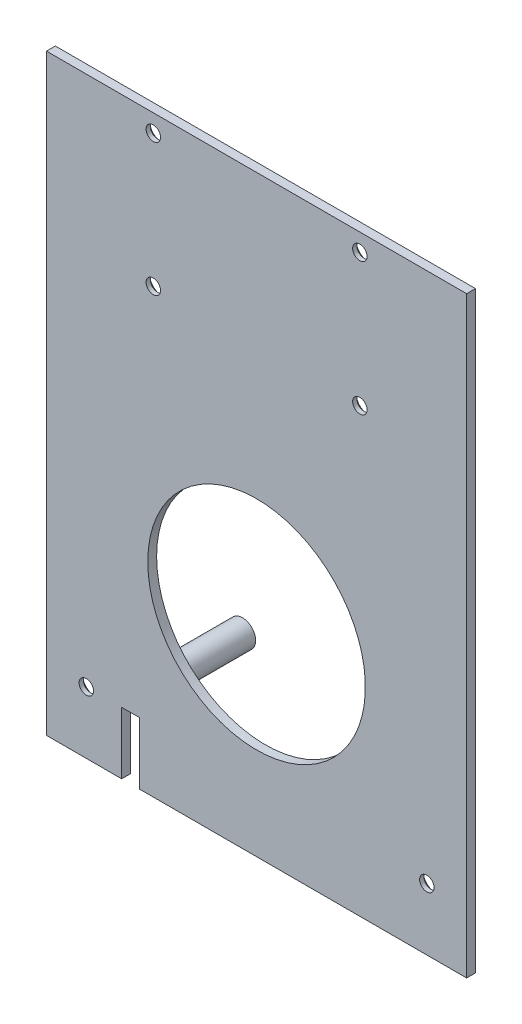
from build123d import *

# Parameters (mm, degrees)
SKETCH1_W                                 = 95
SKETCH1_H                                 = 134
BOSS_EXTRUDE1_DEPTH                       = 2
CSK_FOR_4_FLAT_HEAD_MACHINE_SCREW_2_COUNT = 2
CSK_FOR_4_FLAT_HEAD_MACHINE_SCREW_2_PITCH = 46.7
CSK_FOR_4_FLAT_HEAD_MACHINE_SCREW_3_COUNT = 2
CSK_FOR_4_FLAT_HEAD_MACHINE_SCREW_3_PITCH = 55.505765466
CSK_FOR_4_FLAT_HEAD_MACHINE_SCREW_4_COUNT = 2
CSK_FOR_4_FLAT_HEAD_MACHINE_SCREW_4_PITCH = 30
CSK_FOR_4_FLAT_HEAD_MACHINE_SCREW_5_COUNT = 2
CSK_FOR_4_FLAT_HEAD_MACHINE_SCREW_5_PITCH = 116.985137945
CSK_FOR_4_FLAT_HEAD_MACHINE_SCREW_6_COUNT = 2
CSK_FOR_4_FLAT_HEAD_MACHINE_SCREW_6_PITCH = 131.458824352
SKETCH13_R                                = 24.6
CUT_EXTRUDE2_DEPTH                        = 165.271117364
SKETCH14_R                                = 3
BOSS_EXTRUDE4_DEPTH                       = 19.3
SKETCH15_R                                = 1.15
CUT_EXTRUDE3_DEPTH                        = 15
SKETCH16_W                                = 4
SKETCH16_H                                = 14
CUT_EXTRUDE4_DEPTH                        = 166.388905311


with BuildPart() as part:
    # Sketch1 → Boss-Extrude1 (new body)
    with BuildSketch(Plane.XY):
        with Locations((47.5, 67)):
            Rectangle(SKETCH1_W, SKETCH1_H)
    extrude(amount=BOSS_EXTRUDE1_DEPTH)

    # Sketch8 → CSK for #4 Flat Head Machine Screw (100)2 (revolve, cut)
    with BuildSketch(Plane(origin=(70.85, 130, 0), x_dir=(0, 1, 0), z_dir=(1, 0, 0))):
        Polygon((0, 0), (0, 2), (1.63195, 2), (1.63195, 1.028358553), (2.8575, 0), align=None)
    csk_for_4_flat_head_machine_screw_100 = revolve(axis=Axis((70.85, 130, -6.35), (0, 0, 1)), mode=Mode.SUBTRACT)

    # CSK for _4 Flat Head Machine Screw _ 2: CSK for #4 Flat Head Machine Screw (100)2 ×2
    with Locations(*[(-i * CSK_FOR_4_FLAT_HEAD_MACHINE_SCREW_2_PITCH, 0, 0) for i in range(1, CSK_FOR_4_FLAT_HEAD_MACHINE_SCREW_2_COUNT)]):
        add(csk_for_4_flat_head_machine_screw_100, mode=Mode.SUBTRACT)

    # CSK for _4 Flat Head Machine Screw _ 3: CSK for #4 Flat Head Machine Screw (100)2 ×2
    with Locations(*[Vector(-0.8413540396691381, -0.540484393791738, 0) * (i * CSK_FOR_4_FLAT_HEAD_MACHINE_SCREW_3_PITCH) for i in range(1, CSK_FOR_4_FLAT_HEAD_MACHINE_SCREW_3_COUNT)]):
        add(csk_for_4_flat_head_machine_screw_100, mode=Mode.SUBTRACT)

    # CSK for _4 Flat Head Machine Screw _ 4: CSK for #4 Flat Head Machine Screw (100)2 ×2
    with Locations(*[(0, -i * CSK_FOR_4_FLAT_HEAD_MACHINE_SCREW_4_PITCH, 0) for i in range(1, CSK_FOR_4_FLAT_HEAD_MACHINE_SCREW_4_COUNT)]):
        add(csk_for_4_flat_head_machine_screw_100, mode=Mode.SUBTRACT)

    # CSK for _4 Flat Head Machine Screw _ 5: CSK for #4 Flat Head Machine Screw (100)2 ×2
    with Locations(*[Vector(0.12950362982970207, -0.991578947870986, 0) * (i * CSK_FOR_4_FLAT_HEAD_MACHINE_SCREW_5_PITCH) for i in range(1, CSK_FOR_4_FLAT_HEAD_MACHINE_SCREW_5_COUNT)]):
        add(csk_for_4_flat_head_machine_screw_100, mode=Mode.SUBTRACT)

    # CSK for _4 Flat Head Machine Screw _ 6: CSK for #4 Flat Head Machine Screw (100)2 ×2
    with Locations(*[Vector(-0.47048952632046626, -0.8824055788710445, 0) * (i * CSK_FOR_4_FLAT_HEAD_MACHINE_SCREW_6_PITCH) for i in range(1, CSK_FOR_4_FLAT_HEAD_MACHINE_SCREW_6_COUNT)]):
        add(csk_for_4_flat_head_machine_screw_100, mode=Mode.SUBTRACT)

    # Sketch13 → Cut-Extrude2 (cut, through all)
    with BuildSketch(Plane(origin=(0, 0, 0), x_dir=(-1, 0, 0), z_dir=(0, 0, -1))):
        with Locations((-47.5, 45.5)):
            Circle(SKETCH13_R)
    extrude(amount=-CUT_EXTRUDE2_DEPTH, mode=Mode.SUBTRACT)

    # Sketch14 → Boss-Extrude4 (add)
    with BuildSketch(Plane(origin=(0, 0, 0), x_dir=(-1, 0, 0), z_dir=(0, 0, -1))):
        with Locations((-72, 70.1)):
            Circle(SKETCH14_R)
        with Locations((-23, 70.1)):
            Circle(SKETCH14_R)
        with Locations((-72, 20.9)):
            Circle(SKETCH14_R)
        with Locations((-23, 20.9)):
            Circle(SKETCH14_R)
    extrude(amount=BOSS_EXTRUDE4_DEPTH)

    # Sketch15 → Cut-Extrude3 (cut)
    with BuildSketch(Plane(origin=(0, 0, -19.3), x_dir=(-1, 0, 0), z_dir=(0, 0, -1))):
        with Locations((-72, 70.1)):
            Circle(SKETCH15_R)
        with Locations((-23, 70.1)):
            Circle(SKETCH15_R)
        with Locations((-23, 20.9)):
            Circle(SKETCH15_R)
        with Locations((-72, 20.9)):
            Circle(SKETCH15_R)
    extrude(amount=-CUT_EXTRUDE3_DEPTH, mode=Mode.SUBTRACT)

    # Sketch16 → Cut-Extrude4 (cut, through all)
    with BuildSketch(Plane(origin=(0, 0, 0), x_dir=(-1, 0, 0), z_dir=(0, 0, -1))):
        with Locations((-19, 7)):
            Rectangle(SKETCH16_W, SKETCH16_H)
    extrude(amount=-CUT_EXTRUDE4_DEPTH, mode=Mode.SUBTRACT)


solid = part.part
